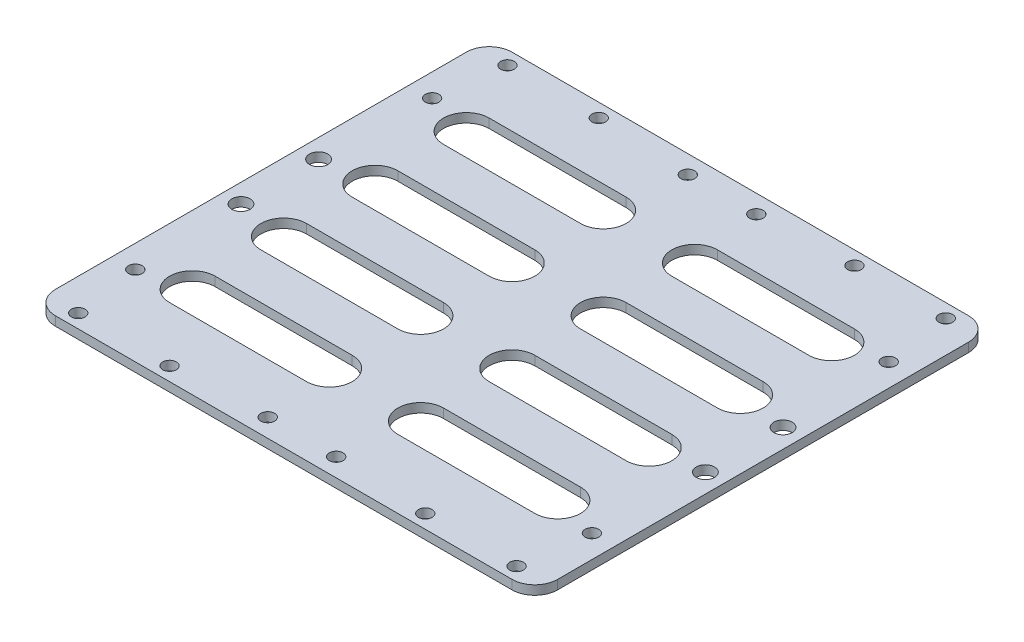
from build123d import *

# Parameters (mm, degrees)
SKETCH_1_W             = 110
SKETCH_1_H             = 100
SKETCH_1_R             = 1.5
SKETCH_1_R_2           = 2
EXTRUDE_1_DEPTH        = 2
FILLET_1_R             = 5
CUT_EXTRUDE_1903_DEPTH = 10
SKETCH_3_R             = 1.5
CUT_EXTRUDE_2113_DEPTH = 10
SKETCH_4_R             = 1.5
CUT_EXTRUDE_2323_DEPTH = 10


with BuildPart() as part:
    # 草图1 → 凸台-拉伸1 (new body)
    with BuildSketch(Plane(origin=(0, 0, 0), x_dir=(1, 0, 0), z_dir=(0, 1, 0))):
        Rectangle(SKETCH_1_W, SKETCH_1_H)
        with Locations(Location((-48, -47, 0), (0, 0, 270))):
            Circle(SKETCH_1_R, mode=Mode.SUBTRACT)
        with Locations(Location((-28, -47, 0), (0, 0, 270))):
            Circle(SKETCH_1_R, mode=Mode.SUBTRACT)
        with Locations(Location((-50.854561817, 8.5, 0), (0, 0, 270))):
            Circle(SKETCH_1_R_2, mode=Mode.SUBTRACT)
        with Locations(Location((-50.854561817, -8.5, 0), (0, 0, 270))):
            Circle(SKETCH_1_R_2, mode=Mode.SUBTRACT)
        with Locations(Location((-28, 47, 0), (0, 0, 270))):
            Circle(SKETCH_1_R, mode=Mode.SUBTRACT)
        with Locations(Location((-48, 47, 0), (0, 0, 270))):
            Circle(SKETCH_1_R, mode=Mode.SUBTRACT)
        with Locations(Location((28, -47, 0), (0, 0, 270))):
            Circle(SKETCH_1_R, mode=Mode.SUBTRACT)
        with Locations(Location((48, -47, 0), (0, 0, 270))):
            Circle(SKETCH_1_R, mode=Mode.SUBTRACT)
        with Locations(Location((48, 47, 0), (0, 0, 270))):
            Circle(SKETCH_1_R, mode=Mode.SUBTRACT)
        with Locations(Location((28, 47, 0), (0, 0, 270))):
            Circle(SKETCH_1_R, mode=Mode.SUBTRACT)
        with Locations(Location((50.854561817, -8.5, 0), (0, 0, 270))):
            Circle(SKETCH_1_R_2, mode=Mode.SUBTRACT)
        with Locations(Location((50.854561817, 8.5, 0), (0, 0, 270))):
            Circle(SKETCH_1_R_2, mode=Mode.SUBTRACT)
    extrude(amount=EXTRUDE_1_DEPTH)

    # 圆角1
    fillet_1_edges = [part.edges().sort_by_distance(p)[0] for p in [
        (55, 1, -50),
        (55, 1, 50),
        (-55, 1, 50),
        (-55, 1, -50),
    ]]
    fillet(fillet_1_edges, radius=FILLET_1_R)

    # 草图2 → Cut-Extrude 1903 (cut)
    with BuildSketch(Plane(origin=(0, 2, 0), x_dir=(1, 0, 0), z_dir=(0, 1, 0))):
        with BuildLine():
            Line((-40, 35), (-10, 35))
            ThreePointArc((-10, 35), (-5, 30), (-10, 25))
            Line((-10, 25), (-40, 25))
            ThreePointArc((-40, 25), (-45, 30), (-40, 35))
        make_face()
        with BuildLine():
            Line((-40, 15), (-10, 15))
            ThreePointArc((-10, 15), (-5, 10), (-10, 5))
            Line((-10, 5), (-40, 5))
            ThreePointArc((-40, 5), (-45, 10), (-40, 15))
        make_face()
        with BuildLine():
            Line((-40, -5), (-10, -5))
            ThreePointArc((-10, -5), (-5, -10), (-10, -15))
            Line((-10, -15), (-40, -15))
            ThreePointArc((-40, -15), (-45, -10), (-40, -5))
        make_face()
        with BuildLine():
            Line((-40, -25), (-10, -25))
            ThreePointArc((-10, -25), (-5, -30), (-10, -35))
            Line((-10, -35), (-40, -35))
            ThreePointArc((-40, -35), (-45, -30), (-40, -25))
        make_face()
        with BuildLine():
            Line((40, 35), (10, 35))
            ThreePointArc((10, 35), (5, 30), (10, 25))
            Line((10, 25), (40, 25))
            ThreePointArc((40, 25), (45, 30), (40, 35))
        make_face()
        with BuildLine():
            Line((40, 15), (10, 15))
            ThreePointArc((10, 15), (5, 10), (10, 5))
            Line((10, 5), (40, 5))
            ThreePointArc((40, 5), (45, 10), (40, 15))
        make_face()
        with BuildLine():
            Line((40, -5), (10, -5))
            ThreePointArc((10, -5), (5, -10), (10, -15))
            Line((10, -15), (40, -15))
            ThreePointArc((40, -15), (45, -10), (40, -5))
        make_face()
        with BuildLine():
            Line((40, -25), (10, -25))
            ThreePointArc((10, -25), (5, -30), (10, -35))
            Line((10, -35), (40, -35))
            ThreePointArc((40, -35), (45, -30), (40, -25))
        make_face()
    extrude(amount=-CUT_EXTRUDE_1903_DEPTH, mode=Mode.SUBTRACT)

    # 草图3 → Cut-Extrude 2113 (cut)
    with BuildSketch(Plane(origin=(0, 2, 0), x_dir=(1, 0, 0), z_dir=(0, 1, 0))):
        with Locations(Location((-7.5, 46, 0), (0, 0, 270))):
            Circle(SKETCH_3_R)
        with Locations(Location((7.5, 46, 0), (0, 0, 270))):
            Circle(SKETCH_3_R)
        with Locations(Location((-7.5, -46, 0), (0, 0, 270))):
            Circle(SKETCH_3_R)
        with Locations(Location((7.5, -46, 0), (0, 0, 270))):
            Circle(SKETCH_3_R)
    extrude(amount=-CUT_EXTRUDE_2113_DEPTH, mode=Mode.SUBTRACT)

    # 草图4 → Cut-Extrude 2323 (cut)
    with BuildSketch(Plane(origin=(0, 2, 0), x_dir=(1, 0, 0), z_dir=(0, 1, 0))):
        with Locations(Location((-50, -32.5, 0), (0, 0, 270))):
            Circle(SKETCH_4_R)
        with Locations(Location((50, -32.5, 0), (0, 0, 270))):
            Circle(SKETCH_4_R)
        with Locations(Location((50, 32.5, 0), (0, 0, 270))):
            Circle(SKETCH_4_R)
        with Locations(Location((-50, 32.5, 0), (0, 0, 270))):
            Circle(SKETCH_4_R)
    extrude(amount=-CUT_EXTRUDE_2323_DEPTH, mode=Mode.SUBTRACT)


solid = part.part
